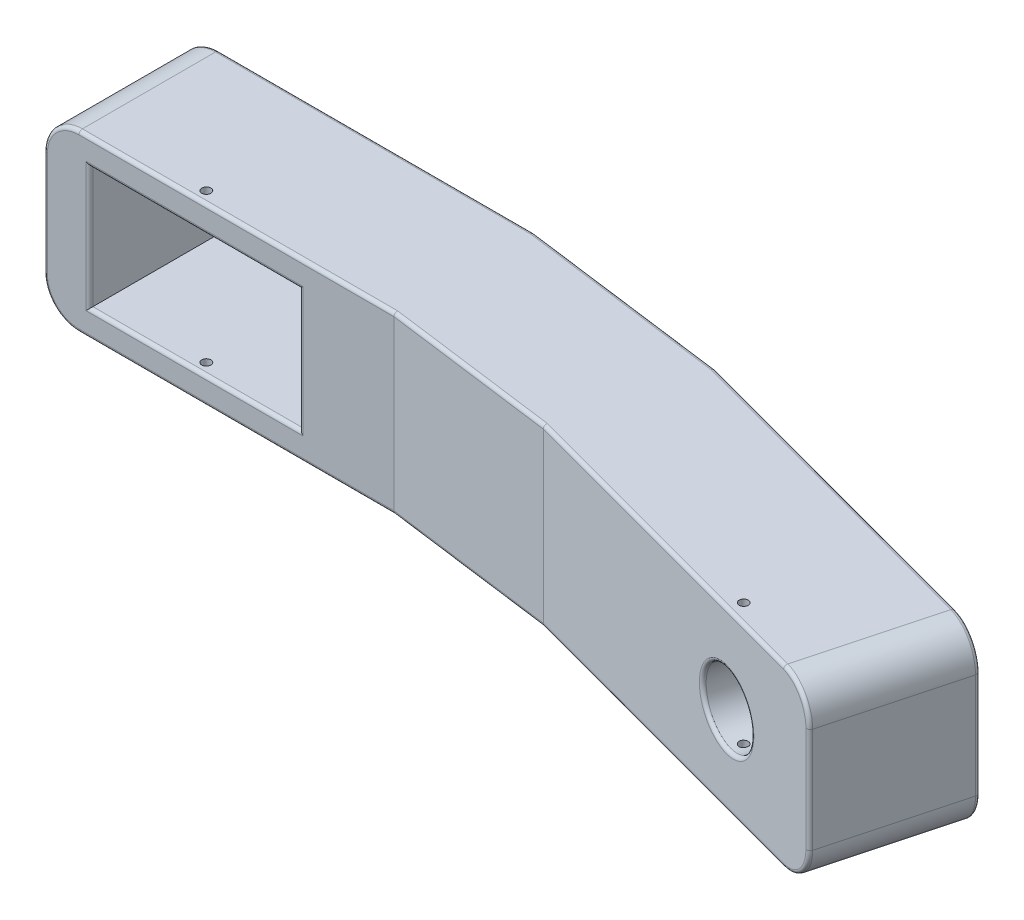
from build123d import *

# Parameters (mm, degrees)
SKETCH_1_W          = 100
SKETCH_1_H          = 50
EXTRUDE_1_DEPTH     = 40
SKETCH_2_W          = 60
SKETCH_2_H          = 17.5
CUT_EXTRUDE_1_DEPTH = 70
SKETCH_4_R          = 1.3
CUT_EXTRUDE_2_DEPTH = 119.74342087
EXTRUDE_2_DEPTH     = 50
SKETCH_6_R          = 10
CUT_EXTRUDE_3_DEPTH = 278.729911697
SKETCH_7_R          = 1.3
CUT_EXTRUDE_4_DEPTH = 278.740409113
FILLET_1_R          = 10
FILLET_2_R          = 1


with BuildPart() as part:
    # 草圖1 → 填料-伸長1 (new body)
    with BuildSketch(Plane.XY):
        with Locations((50, 25)):
            Rectangle(SKETCH_1_W, SKETCH_1_H)
    extrude(amount=EXTRUDE_1_DEPTH)

    # 草圖2 → 除料-伸長1 (cut)
    with BuildSketch(Plane.XY.offset(40)):
        with Locations((43, 33.75)):
            Rectangle(SKETCH_2_W, SKETCH_2_H)
        with Locations((43, 16.25)):
            Rectangle(SKETCH_2_W, SKETCH_2_H)
    extrude(amount=-CUT_EXTRUDE_1_DEPTH, mode=Mode.SUBTRACT)

    # 草圖4 → 除料-伸長2 (cut, through all)
    with BuildSketch(Plane(origin=(0, 50, 0), x_dir=(1, 0, 0), z_dir=(0, 1, 0))):
        with Locations(Location((43, -36.6, 0), (0, 0, 270))):
            Circle(SKETCH_4_R)
    extrude(amount=-CUT_EXTRUDE_2_DEPTH, mode=Mode.SUBTRACT)

    # 草圖5 → 填料-伸長2 (add)
    with BuildSketch(Plane(origin=(0, 50, 0), x_dir=(1, 0, 0), z_dir=(0, 1, 0))):
        Polygon((149.133929878, -46.468604585), (100, -40), (100, 0), (159.486691682, -7.831571533), (262.937008695, -35.551000434), (252.584246891, -74.188033485), align=None)
    extrude(amount=-EXTRUDE_2_DEPTH)

    # 草圖6 → 除料-伸長3 (cut, through all)
    with BuildSketch(Plane(origin=(-1.627072127, 0, 6.072315847), x_dir=(0.9659258262890664, 0, 0.2588190451025279), z_dir=(-0.25881904510252796, 0, 0.9659258262890664))):
        with Locations((230.147023393, 25)):
            Circle(SKETCH_6_R)
    extrude(amount=-CUT_EXTRUDE_3_DEPTH, mode=Mode.SUBTRACT)

    # 草圖7 → 除料-伸長4 (cut, through all)
    with BuildSketch(Plane(origin=(0, 50, 0), x_dir=(1, 0, 0), z_dir=(0, 1, 0))):
        with Locations(Location((221.713157792, -61.77504537, 0), (0, 0, 270))):
            Circle(SKETCH_7_R)
    extrude(amount=-CUT_EXTRUDE_4_DEPTH, mode=Mode.SUBTRACT)

    # 圓角1
    fillet_1_edges = [part.edges().sort_by_distance(p)[0] for p in [
        (257.760627793, 0, 54.869516959),
        (257.760627793, 50, 54.869516959),
        (0, 50, 20),
        (0, 0, 20),
    ]]
    fillet(fillet_1_edges, radius=FILLET_1_R)

    # 圓角2
    fillet_2_edges = [part.edges().sort_by_distance(p)[0] for p in [
        (55, 50, 40),
        (43, 7.5, 0),
        (73, 25, 0),
        (43, 42.5, 0),
        (13, 25, 0),
        (43, 42.5, 40),
        (73, 25, 40),
        (13, 25, 40),
        (43, 7.5, 40),
        (196.029459253, 0, 59.034223809),
        (206.382221057, 50, 20.397190758),
        (129.743345841, 0, 3.915785767),
        (129.743345841, 50, 3.915785767),
        (124.566964939, 0, 43.234302292),
        (124.566964939, 50, 43.234302292),
        (55, 50, 0),
        (211.018623349, 25, 63.050558224),
        (252.584246891, 25, 74.188033485),
        (262.937008695, 25, 35.551000434),
        (196.029459253, 50, 59.034223809),
        (249.755115647, 2.928932188, 73.429970053),
        (249.755115647, 47.071067812, 73.429970053),
        (206.382221057, 0, 20.397190758),
        (260.107877451, 2.928932188, 34.792937001),
        (260.107877451, 47.071067812, 34.792937001),
        (55, 0, 0),
        (55, 0, 40),
        (0, 25, 0),
        (0, 25, 40),
        (2.928932188, 2.928932188, 0),
        (2.928932188, 47.071067812, 0),
        (2.928932188, 2.928932188, 40),
        (2.928932188, 47.071067812, 40),
    ]]
    fillet(fillet_2_edges, radius=FILLET_2_R)


solid = part.part
